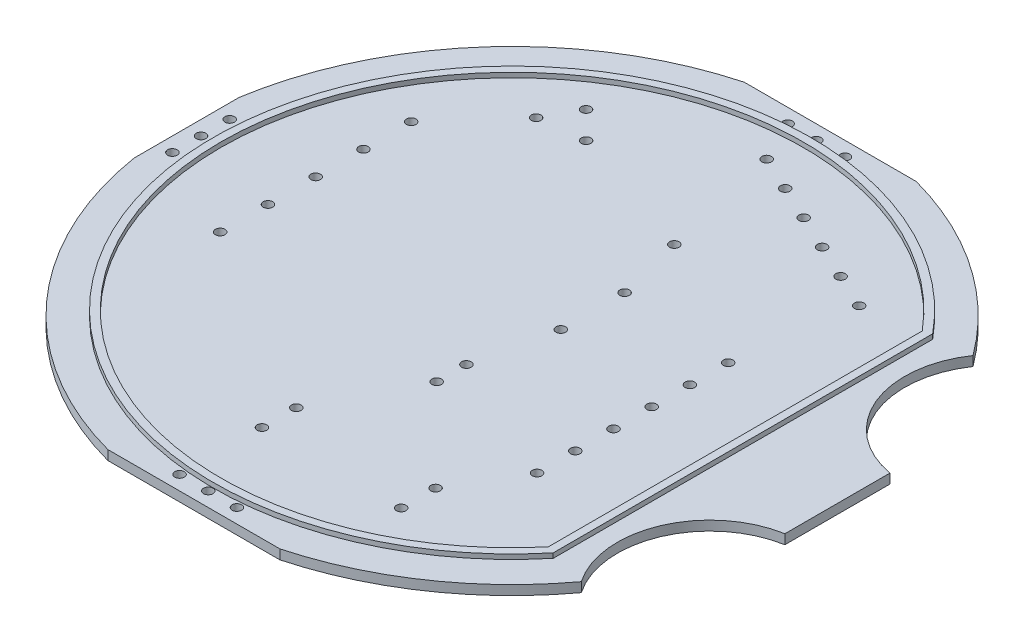
from build123d import *

# Parameters (mm, degrees)
EXTRUSION1_DEPTH       = 2.5
EXTRUSION1_DEPTH_BACK  = 2.5
SKETCH1_R              = 172.5
EXTRUSION2_DEPTH       = 244.964649079
EXTRUSION2_DEPTH_BACK  = 244.964649079
EXTRUSION3_DEPTH       = 240.778543661
EXTRUSION3_DEPTH_BACK  = 240.778543661
EXTRUSION4_DEPTH       = 239.196347579
EXTRUSION4_DEPTH_BACK  = 239.196347579
EXTRUSION8_DEPTH       = 239.196347579
EXTRUSION8_DEPTH_BACK  = 239.196347579
SKETCH7_R              = 2.5
EXTRUSION9_DEPTH       = 239.196347579
EXTRUSION9_DEPTH_BACK  = 239.196347579
SKETCH8_R              = 2.5
EXTRUSION10_DEPTH      = 239.196347579
EXTRUSION10_DEPTH_BACK = 239.196347579
SKETCH9_R              = 2.5
EXTRUSION11_DEPTH      = 5
SKETCH11_R             = 2.5
SKETCH11_R_2           = 2.51471315
CUT_EXTRUDE1_DEPTH     = 27


with BuildPart() as part:
    # Sketch1 → Extrusion1 (new, two sides: drawn at the far end of the back side and taken through both)
    with BuildSketch(Plane(origin=(0, 0, 0), x_dir=(-1, 0, 0), z_dir=(0, 1, 0)).offset(-EXTRUSION1_DEPTH_BACK)):
        with Locations(Location((0, 0, 0), (0, 0, 90))):
            Circle(SKETCH1_R)
    extrude(amount=EXTRUSION1_DEPTH + EXTRUSION1_DEPTH_BACK)

    # Sketch2 → Extrusion2 (cut, two sides: drawn at the far end of the back side and taken through both)
    with BuildSketch(Plane(origin=(0, 0, 0), x_dir=(1, 0, 0), z_dir=(0, 1, 0)).offset(-EXTRUSION2_DEPTH_BACK)):
        with BuildLine():
            Line((45, -166.527024834), (-45, -166.527024834))
            ThreePointArc((-45, -166.527024834), (0, -172.5), (45, -166.527024834))
        make_face()
        with BuildLine():
            Line((-45, 166.527024834), (45, 166.527024834))
            ThreePointArc((45, 166.527024834), (0, 172.5), (-45, 166.527024834))
        make_face()
        with BuildLine():
            Line((-170.293863659, -27.5), (-170.293863659, 27.5))
            ThreePointArc((-170.293863659, 27.5), (-172.5, 0), (-170.293863659, -27.5))
        make_face()
    extrude(amount=EXTRUSION2_DEPTH + EXTRUSION2_DEPTH_BACK, mode=Mode.SUBTRACT)

    # Sketch3 → Extrusion3 (cut, two sides: drawn at the far end of the back side and taken through both)
    with BuildSketch(Plane(origin=(0, 0, 0), x_dir=(1, 0, 0), z_dir=(0, 1, 0)).offset(-EXTRUSION3_DEPTH_BACK)):
        with BuildLine():
            Line((170.293863659, -27.5), (170.293863659, 27.5))
            ThreePointArc((170.293863659, 27.5), (172.5, 0), (170.293863659, -27.5))
        make_face()
    extrude(amount=EXTRUSION3_DEPTH + EXTRUSION3_DEPTH_BACK, mode=Mode.SUBTRACT)

    # Sketch4 → Extrusion4 (cut, two sides: drawn at the far end of the back side and taken through both)
    with BuildSketch(Plane(origin=(0, 0, 0), x_dir=(1, 0, 0), z_dir=(0, 1, 0)).offset(-EXTRUSION4_DEPTH_BACK)):
        with BuildLine():
            ThreePointArc((170.293863659, -27.5), (134.081167118, -56.402573756), (138.744369255, -102.5))
            ThreePointArc((138.744369255, -102.5), (159.00442557, -66.886789797), (170.293863659, -27.5))
        make_face()
        with BuildLine():
            ThreePointArc((170.293863659, 27.5), (159.00442557, 66.886789797), (138.744369255, 102.5))
            ThreePointArc((138.744369255, 102.5), (134.081167118, 56.402573756), (170.293863659, 27.5))
        make_face()
    extrude(amount=EXTRUSION4_DEPTH + EXTRUSION4_DEPTH_BACK, mode=Mode.SUBTRACT)

    # Sketch7 → Extrusion8 (cut, two sides: drawn at the far end of the back side and taken through both)
    with BuildSketch(Plane(origin=(0, 0, 0), x_dir=(1, 0, 0), z_dir=(0, 1, 0)).offset(-EXTRUSION8_DEPTH_BACK)):
        with Locations(Location((-162.793863659, -15, 0), (0, 0, 270))):
            Circle(SKETCH7_R)
        with Locations(Location((-162.793863659, 0, 0), (0, 0, 270))):
            Circle(SKETCH7_R)
        with Locations(Location((-162.793863659, 15, 0), (0, 0, 270))):
            Circle(SKETCH7_R)
    extrude(amount=EXTRUSION8_DEPTH + EXTRUSION8_DEPTH_BACK, mode=Mode.SUBTRACT)

    # Sketch8 → Extrusion9 (cut, two sides: drawn at the far end of the back side and taken through both)
    with BuildSketch(Plane(origin=(0, 0, 0), x_dir=(1, 0, 0), z_dir=(0, 1, 0)).offset(-EXTRUSION9_DEPTH_BACK)):
        with Locations(Location((-15, -159.027024834, 0), (0, 0, 270))):
            Circle(SKETCH8_R)
        with Locations(Location((0, -159.027024834, 0), (0, 0, 270))):
            Circle(SKETCH8_R)
        with Locations(Location((15, -159.027024834, 0), (0, 0, 270))):
            Circle(SKETCH8_R)
    extrude(amount=EXTRUSION9_DEPTH + EXTRUSION9_DEPTH_BACK, mode=Mode.SUBTRACT)

    # Sketch9 → Extrusion10 (cut, two sides: drawn at the far end of the back side and taken through both)
    with BuildSketch(Plane(origin=(0, 0, 0), x_dir=(1, 0, 0), z_dir=(0, 1, 0)).offset(-EXTRUSION10_DEPTH_BACK)):
        with Locations(Location((0.205214566, 159.027024834, 0), (0, 0, 270))):
            Circle(SKETCH9_R)
        with Locations(Location((-14.794785434, 159.027024834, 0), (0, 0, 270))):
            Circle(SKETCH9_R)
        with Locations(Location((15.205214566, 159.027024834, 0), (0, 0, 270))):
            Circle(SKETCH9_R)
    extrude(amount=EXTRUSION10_DEPTH + EXTRUSION10_DEPTH_BACK, mode=Mode.SUBTRACT)

    # Sketch10 → Extrusion11 (add)
    with BuildSketch(Plane(origin=(0, 0, 0), x_dir=(1, 0, 0), z_dir=(0, 1, 0))):
        with BuildLine():
            Line((120.84, -99.290756871), (120.84, 99.290756871))
            ThreePointArc((120.84, 99.290756871), (-156.4, 0), (120.84, -99.290756871))
        make_face()
        with BuildLine():
            ThreePointArc((116.84, 97.847710244), (-152.4, 0), (116.84, -97.847710244))
            Line((116.84, -97.847710244), (116.84, 97.847710244))
        make_face(mode=Mode.SUBTRACT)
    extrude(amount=EXTRUSION11_DEPTH)

    # Sketch11 → Cut-Extrude1 (cut)
    with BuildSketch(Plane(origin=(0, -2.5, 0), x_dir=(-1, 0, 0), z_dir=(0, -1, 0))):
        with Locations(Location((114.237315354, 61.453329839, 0), (0, 0, 90))):
            Circle(SKETCH11_R)
        with Locations(Location((114.237315354, 36.453329839, 0), (0, 0, 90))):
            Circle(SKETCH11_R)
        with Locations(Location((114.237315354, 11.453329839, 0), (0, 0, 90))):
            Circle(SKETCH11_R)
        with Locations(Location((114.237315354, -13.546670161, 0), (0, 0, 90))):
            Circle(SKETCH11_R)
        with Locations(Location((114.237315354, -38.546670161, 0), (0, 0, 90))):
            Circle(SKETCH11_R)
        with Locations(Location((83.382192066, 95.959187947, 0), (0, 0, 90))):
            Circle(SKETCH11_R)
        with Locations(Location((74.039046315, 112.7789931, 0), (0, 0, 90))):
            Circle(SKETCH11_R)
        with Locations(Location((59.896910692, 98.636857477, 0), (0, 0, 90))):
            Circle(SKETCH11_R)
        with Locations(Location((-10.262684646, 74.659187947, 0), (0, 0, 90))):
            Circle(SKETCH11_R)
        with Locations(Location((-10.262684646, -34.140812053, 0), (0, 0, 90))):
            Circle(SKETCH11_R)
        with Locations(Location((-10.262684646, -49.740812053, 0), (0, 0, 90))):
            Circle(SKETCH11_R)
        with Locations(Location((-77.94, -64.847710244, 0), (0, 0, 90))):
            Circle(SKETCH11_R)
        with Locations(Location((-77.94, -44.847710244, 0), (0, 0, 90))):
            Circle(SKETCH11_R)
        with Locations(Location((-77.94, -24.847710244, 0), (0, 0, 90))):
            Circle(SKETCH11_R_2)
        with Locations(Location((-77.94, -4.847710244, 0), (0, 0, 90))):
            Circle(SKETCH11_R)
        with Locations(Location((-77.94, 15.152289756, 0), (0, 0, 90))):
            Circle(SKETCH11_R)
        with Locations(Location((-77.94, 35.152289756, 0), (0, 0, 90))):
            Circle(SKETCH11_R)
        with Locations(Location((-86.382165944, 95.260023358, 0), (0, 0, 90))):
            Circle(SKETCH11_R)
        with Locations(Location((-68.256010203, 103.712388593, 0), (0, 0, 90))):
            Circle(SKETCH11_R)
        with Locations(Location((-50.129854462, 112.164753828, 0), (0, 0, 90))):
            Circle(SKETCH11_R)
        with Locations(Location((-32.003698722, 120.617119063, 0), (0, 0, 90))):
            Circle(SKETCH11_R)
        with Locations(Location((-13.877542981, 129.069484298, 0), (0, 0, 90))):
            Circle(SKETCH11_R)
        with Locations(Location((4.24861276, 137.521849532, 0), (0, 0, 90))):
            Circle(SKETCH11_R)
        with Locations(Location((14.693361821, -98.240812053, 0), (0, 0, 90))):
            Circle(SKETCH11_R)
        with Locations(Location((14.693361821, -116.240812053, 0), (0, 0, 90))):
            Circle(SKETCH11_R)
        with Locations(Location((-58.218731113, -116.240812053, 0), (0, 0, 90))):
            Circle(SKETCH11_R)
        with Locations(Location((-58.218731113, -98.240812053, 0), (0, 0, 90))):
            Circle(SKETCH11_R)
        with Locations(Location((-19.084661413, 39.809187947, 0), (0, 0, 90))):
            Circle(SKETCH11_R)
        with Locations(Location((-19.084661413, 6.409187947, 0), (0, 0, 90))):
            Circle(SKETCH11_R)
    extrude(amount=-CUT_EXTRUDE1_DEPTH, mode=Mode.SUBTRACT)


solid = part.part
